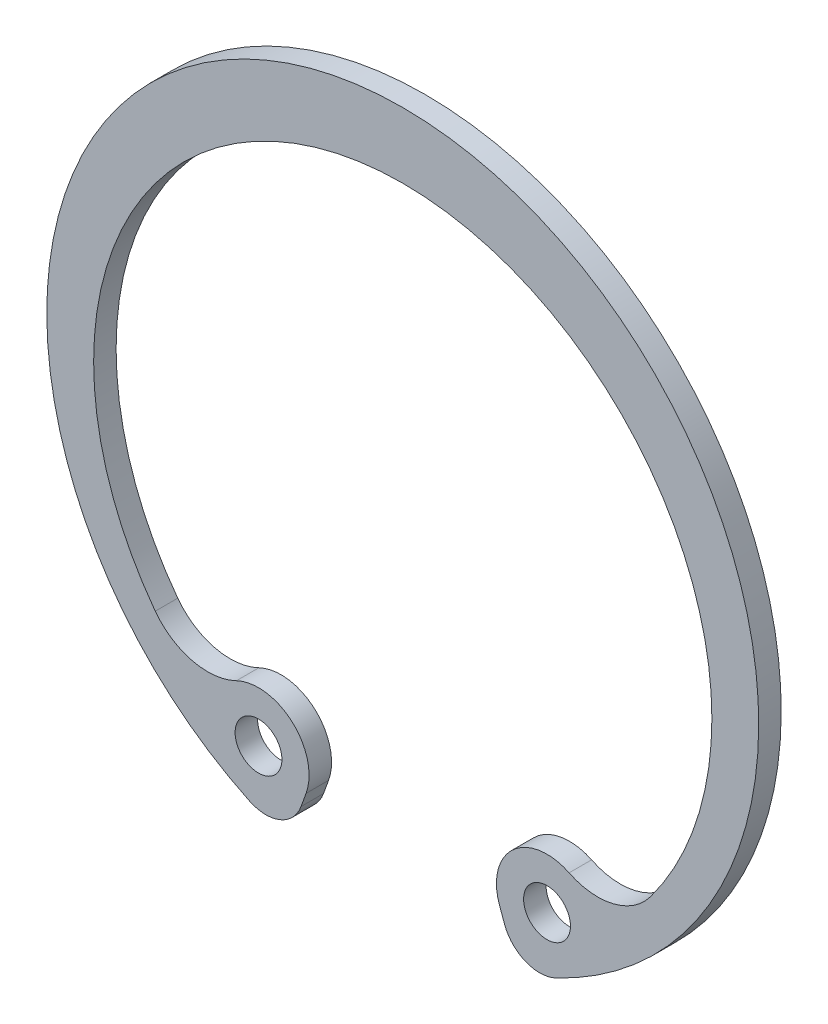
from build123d import *

# Parameters (mm, degrees)
SKETCH_1_R      = 1.25
EXTRUDE_1_DEPTH = 1.2


with BuildPart() as part:
    # Эскиз1 → Бобышка-Вытянуть1 (new body)
    with BuildSketch(Plane.XY):
        with BuildLine():
            Line((-5.160647232, -15.284063293), (-5.429258829, -16.027548533))
            ThreePointArc((-5.429258829, -16.027548533), (-6.550261386, -17.197940013), (-8.170291571, -17.153609989))
            ThreePointArc((-8.170291571, -17.153609989), (0, 19), (8.170291571, -17.153609989))
            ThreePointArc((8.170291571, -17.153609989), (6.550261386, -17.197940013), (5.429258829, -16.027548533))
            Line((5.429258829, -16.027548533), (5.160647232, -15.284063293))
            ThreePointArc((5.160647232, -15.284063293), (5.893948192, -12.359596142), (8.879298744, -11.937789906))
            ThreePointArc((8.879298744, -11.937789906), (11.233706363, -12.19050777), (13.210178389, -10.88641426))
            ThreePointArc((13.210178389, -10.88641426), (0, 15.5), (-13.210178389, -10.88641426))
            ThreePointArc((-13.210178389, -10.88641426), (-11.233706363, -12.19050777), (-8.879298744, -11.937789906))
            ThreePointArc((-8.879298744, -11.937789906), (-5.893948192, -12.359596142), (-5.160647232, -15.284063293))
        make_face()
        with Locations((-7.7, -14.366627997)):
            Circle(SKETCH_1_R, mode=Mode.SUBTRACT)
        with Locations((7.7, -14.366627997)):
            Circle(SKETCH_1_R, mode=Mode.SUBTRACT)
    extrude(amount=EXTRUDE_1_DEPTH)


solid = part.part
